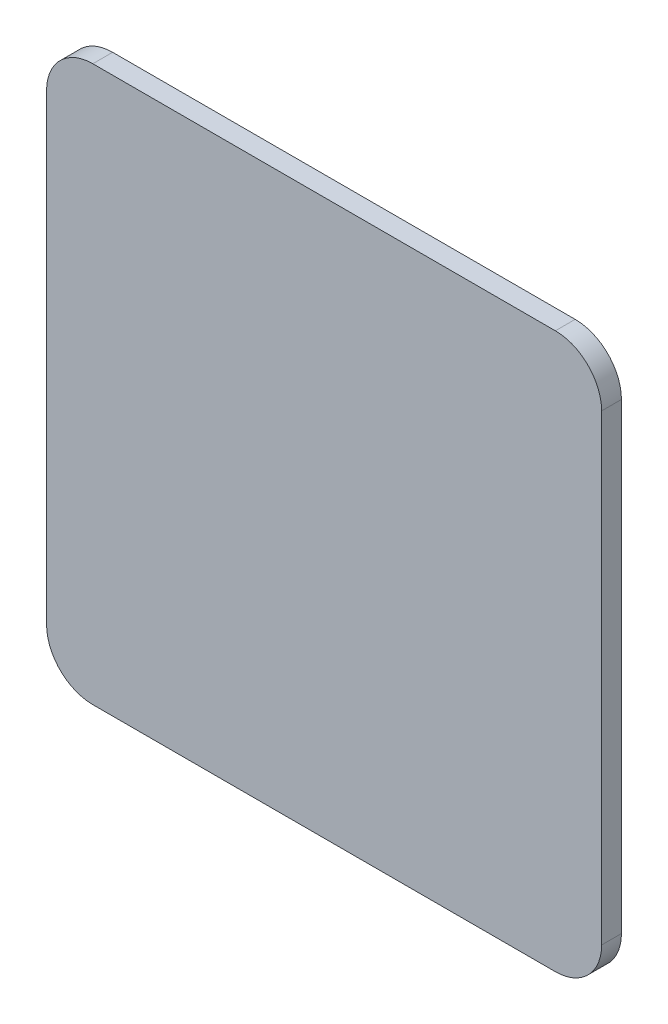
from build123d import *

# Parameters (mm, degrees)
SKETCH1_W           = 84
SKETCH1_H           = 84
BOSS_EXTRUDE1_DEPTH = 3
FILLET1_R           = 7


with BuildPart() as part:
    # Sketch1 → Boss-Extrude1 (new body)
    with BuildSketch(Plane.XY):
        Rectangle(SKETCH1_W, SKETCH1_H)
    extrude(amount=BOSS_EXTRUDE1_DEPTH)

    # Fillet1
    fillet1_edges = [part.edges().sort_by_distance(p)[0] for p in [
        (42, -42, 1.5),
        (-42, -42, 1.5),
        (-42, 42, 1.5),
        (42, 42, 1.5),
    ]]
    fillet(fillet1_edges, radius=FILLET1_R)


solid = part.part
